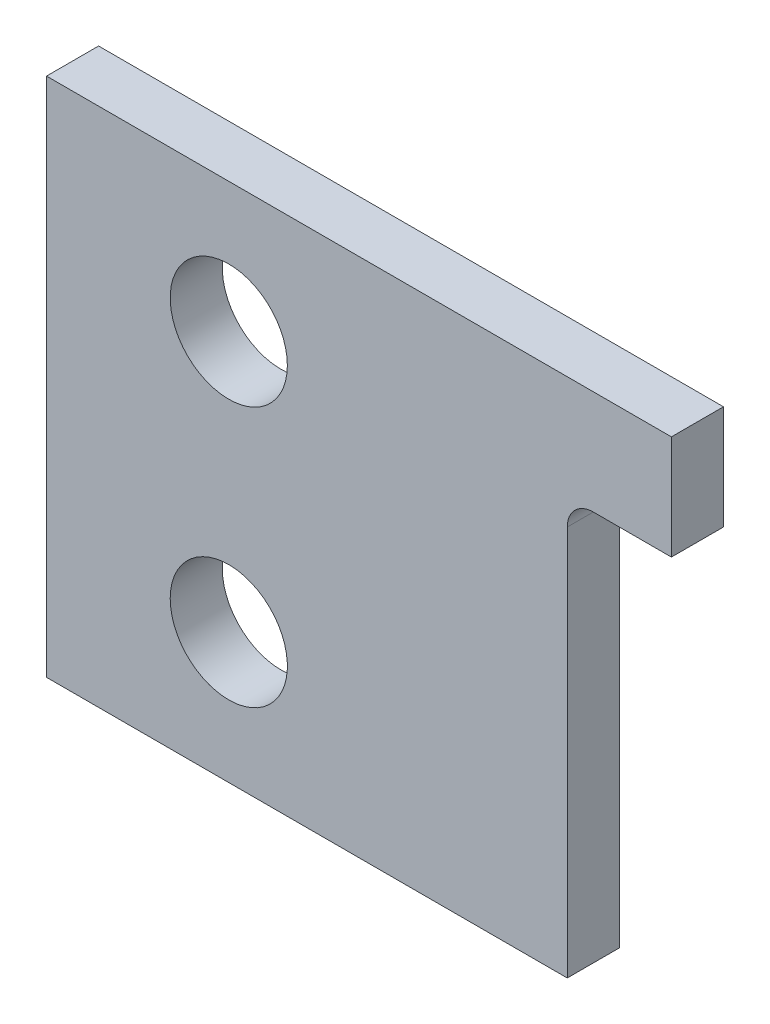
from build123d import *

# Parameters (mm, degrees)
SKETCH_1_W          = 60
SKETCH_1_H          = 20
EXTRUDE_1_DEPTH     = 2
SKETCH_2_W          = 20
SKETCH_2_H          = 16
CUT_EXTRUDE_1_DEPTH = 64.277168078
FILLET_1_R          = 1
SKETCH_3_R          = 2.25
CUT_EXTRUDE_2_DEPTH = 64.277168078
SKETCH_4_W          = 36
SKETCH_4_H          = 20
CUT_EXTRUDE_3_DEPTH = 10


with BuildPart() as part:
    # 草图1 → 凸台-拉伸1 (new body)
    with BuildSketch(Plane.XY):
        with Locations((30, 10)):
            Rectangle(SKETCH_1_W, SKETCH_1_H)
    extrude(amount=EXTRUDE_1_DEPTH)

    # 草图2 → 切除-拉伸1 (cut, through all)
    with BuildSketch(Plane.XY.offset(2)):
        with Locations((30, 8)):
            Rectangle(SKETCH_2_W, SKETCH_2_H)
    extrude(amount=-CUT_EXTRUDE_1_DEPTH, mode=Mode.SUBTRACT)

    # 圆角1
    fillet_1_edges = [part.edges().sort_by_distance(p)[0] for p in [
        (20, 16, 1),
        (40, 16, 1),
    ]]
    fillet(fillet_1_edges, radius=FILLET_1_R)

    # 草图3 → 切除-拉伸2 (cut, through all)
    with BuildSketch(Plane.XY.offset(2)):
        with Locations((7, 15)):
            Circle(SKETCH_3_R)
        with Locations(Location((53, 15, 0), (0, 0, 180))):
            Circle(SKETCH_3_R)
        with Locations((53, 5)):
            Circle(SKETCH_3_R)
        with Locations(Location((7, 5, 0), (0, 0, 180))):
            Circle(SKETCH_3_R)
    extrude(amount=-CUT_EXTRUDE_2_DEPTH, mode=Mode.SUBTRACT)

    # 草图4 → 切除-拉伸3 (cut)
    with BuildSketch(Plane.XY.offset(2)):
        with Locations((42, 10)):
            Rectangle(SKETCH_4_W, SKETCH_4_H)
    extrude(amount=-CUT_EXTRUDE_3_DEPTH, mode=Mode.SUBTRACT)


solid = part.part
